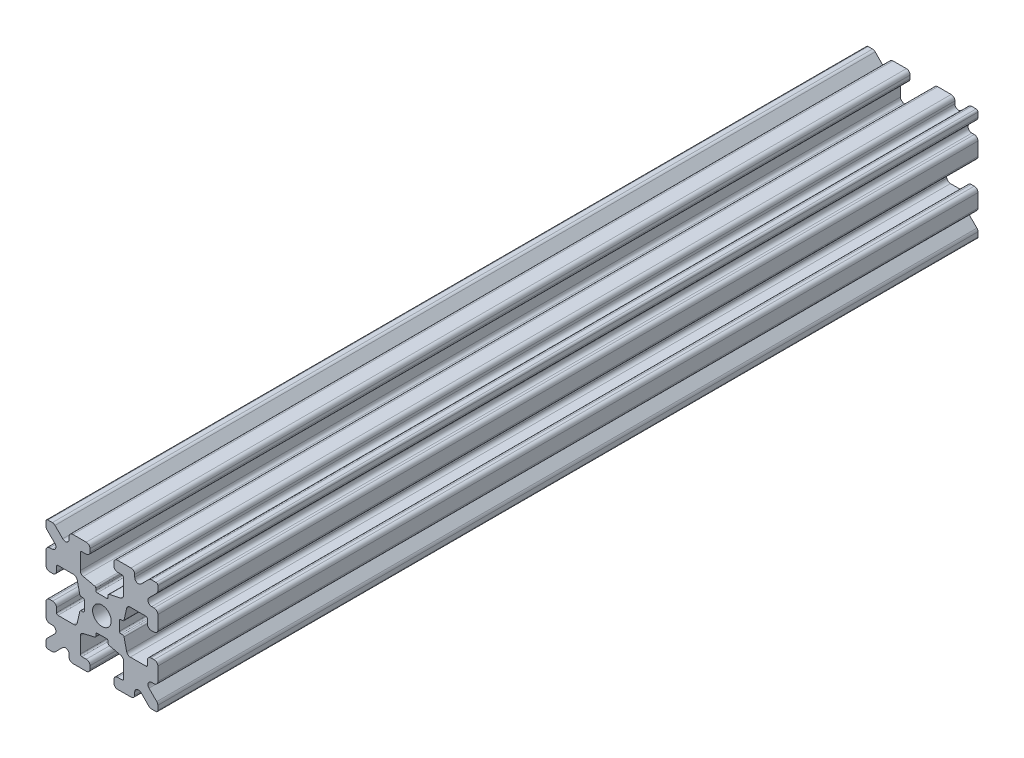
from build123d import *

# Parameters (mm, degrees)
SKETCH1_W           = 15
SKETCH1_H           = 15
SKETCH1_R           = 1.25
BOSS_EXTRUDE1_DEPTH = 55
FILLET1_R           = 0.25
CUT_EXTRUDE1_DEPTH  = 111.510180527
CUT_EXTRUDE3_DEPTH  = 111.510180527
FILLET3_R           = 0.5
FILLET4_R           = 0.5
FILLET5_R           = 3
FILLET6_R           = 0.2
CUT_EXTRUDE4_DEPTH  = 111.510180527
FILLET8_R           = 0.5
SKETCH6_W           = 5.1529354
SKETCH6_H           = 1.651
SKETCH6_W_2         = 1.651
SKETCH6_H_2         = 5.1529354
CUT_EXTRUDE5_DEPTH  = 111.510180527
FILLET10_R          = 0.2


with BuildPart() as part:
    # Sketch1 → Boss-Extrude1 (new, symmetric)
    with BuildSketch(Plane.XY):
        Rectangle(SKETCH1_W, SKETCH1_H)
        Circle(SKETCH1_R, mode=Mode.SUBTRACT)
    extrude(amount=BOSS_EXTRUDE1_DEPTH, both=True)

    # Fillet1
    fillet1_edges = [part.edges().sort_by_distance(p)[0] for p in [
        (7.5, -7.5, 0),
        (-7.5, -7.5, 0),
        (-7.5, 7.5, 0),
        (7.5, 7.5, 0),
    ]]
    fillet(fillet1_edges, radius=FILLET1_R)

    # Sketch2 → Cut-Extrude1 (cut, through all)
    with BuildSketch(Plane.XY.offset(55)):
        Polygon((-7.5, 1.6), (-6.1, 1.6), (-6.1, 2.9), (-3.4, 2.9), (-3.4, -2.9), (-6.1, -2.9), (-6.1, -1.6), (-7.5, -1.6), align=None)
        Polygon((2.9, 6.1), (1.6, 6.1), (1.6, 7.5), (-1.6, 7.5), (-1.6, 6.1), (-2.9, 6.1), (-2.9, 3.4), (2.9, 3.4), align=None)
        Polygon((-1.6, -7.5), (-1.6, -6.1), (-2.9, -6.1), (-2.9, -3.4), (2.9, -3.4), (2.9, -6.1), (1.6, -6.1), (1.6, -7.5), align=None)
        Polygon((6.1, -2.9), (6.1, -1.6), (7.5, -1.6), (7.5, 1.6), (6.1, 1.6), (6.1, 2.9), (3.4, 2.9), (3.4, -2.9), align=None)
    extrude(amount=-CUT_EXTRUDE1_DEPTH, mode=Mode.SUBTRACT)

    # Sketch4 → Cut-Extrude3 (cut, through all)
    with BuildSketch(Plane.XY.offset(55)):
        Polygon((-3.4, 2.9), (-2.75, 0), (-3.4, -2.9), align=None)
        Polygon((-2.9, 3.4), (0, 2.75), (2.9, 3.4), align=None)
        Polygon((3.4, 2.9), (2.75, 0), (3.4, -2.9), align=None)
        Polygon((-2.9, -3.4), (0, -2.75), (2.9, -3.4), align=None)
    extrude(amount=-CUT_EXTRUDE3_DEPTH, mode=Mode.SUBTRACT)

    # Fillet3
    fillet3_edges = [part.edges().sort_by_distance(p)[0] for p in [
        (1.6, -7.5, 0),
        (-1.6, -7.5, 0),
        (-1.6, -6.1, 0),
        (1.6, -6.1, 0),
        (6.1, 1.6, 0),
        (7.5, 1.6, 0),
        (7.5, -1.6, 0),
        (6.1, -1.6, 0),
        (-7.5, -1.6, 0),
        (-7.5, 1.6, 0),
        (-6.1, 1.6, 0),
        (-6.1, -1.6, 0),
        (-1.6, 6.1, 0),
        (-1.6, 7.5, 0),
        (1.6, 7.5, 0),
        (1.6, 6.1, 0),
    ]]
    fillet(fillet3_edges, radius=FILLET3_R)

    # Fillet4
    fillet4_edges = [part.edges().sort_by_distance(p)[0] for p in [
        (-2.9, -3.4, 0),
        (2.9, -3.4, 0),
        (3.4, -2.9, 0),
        (3.4, 2.9, 0),
        (-3.4, 2.9, 0),
        (-3.4, -2.9, 0),
        (2.9, 3.4, 0),
        (-2.9, 3.4, 0),
    ]]
    fillet(fillet4_edges, radius=FILLET4_R)

    # Fillet5
    fillet5_edges = [part.edges().sort_by_distance(p)[0] for p in [
        (-2.75, 0, 0),
        (0, 2.75, 0),
        (2.75, 0, 0),
        (0, -2.75, 0),
    ]]
    fillet(fillet5_edges, radius=FILLET5_R)

    # Fillet6
    fillet6_edges = [part.edges().sort_by_distance(p)[0] for p in [
        (-2.9, -6.1, 0),
        (2.9, -6.1, 0),
        (6.1, -2.9, 0),
        (6.1, 2.9, 0),
        (-6.1, 2.9, 0),
        (-6.1, -2.9, 0),
        (2.9, 6.1, 0),
        (-2.9, 6.1, 0),
    ]]
    fillet(fillet6_edges, radius=FILLET6_R)

    # Sketch5 → Cut-Extrude4 (cut, through all)
    with BuildSketch(Plane.XY.offset(55)):
        Polygon((-7.5, 6.439339828), (-5.460660172, 4.4), (-7.5, 4.4), align=None)
        Polygon((-6.439339828, 7.5), (-4.4, 5.460660172), (-4.4, 7.5), align=None)
        Polygon((4.4, 7.5), (6.439339828, 7.5), (4.4, 5.460660172), align=None)
        Polygon((7.5, 6.439339828), (7.5, 4.4), (5.460660172, 4.4), align=None)
        Polygon((7.5, -6.439339828), (5.460660172, -4.4), (7.5, -4.4), align=None)
        Polygon((6.439339828, -7.5), (4.4, -5.460660172), (4.4, -7.5), align=None)
        Polygon((-4.4, -7.5), (-6.439339828, -7.5), (-4.4, -5.460660172), align=None)
        Polygon((-7.5, -6.439339828), (-7.5, -4.4), (-5.460660172, -4.4), align=None)
    extrude(amount=-CUT_EXTRUDE4_DEPTH, mode=Mode.SUBTRACT)

    # Fillet8
    fillet8_edges = [part.edges().sort_by_distance(p)[0] for p in [
        (-7.5, 4.4, 0),
        (-7.5, 6.439339828, 0),
        (-5.460660172, 4.4, 0),
        (7.5, -4.4, 0),
        (7.5, -6.439339828, 0),
        (5.460660172, -4.4, 0),
        (5.460660172, 4.4, 0),
        (7.5, 6.439339828, 0),
        (7.5, 4.4, 0),
        (-4.4, 7.5, 0),
        (-4.4, 5.460660172, 0),
        (-6.439339828, 7.5, 0),
        (-5.460660172, -4.4, 0),
        (-7.5, -6.439339828, 0),
        (-7.5, -4.4, 0),
        (4.4, 5.460660172, 0),
        (4.4, 7.5, 0),
        (6.439339828, 7.5, 0),
        (6.439339828, -7.5, 0),
        (4.4, -7.5, 0),
        (4.4, -5.460660172, 0),
        (-6.439339828, -7.5, 0),
        (-4.4, -5.460660172, 0),
        (-4.4, -7.5, 0),
    ]]
    fillet(fillet8_edges, radius=FILLET8_R)

    # Sketch6 → Cut-Extrude5 (cut, through all)
    with BuildSketch(Plane.XY.offset(55)):
        with Locations((4.9235323, 0)):
            Rectangle(SKETCH6_W, SKETCH6_H)
        with Locations((0, -4.9235323)):
            Rectangle(SKETCH6_W_2, SKETCH6_H_2)
        with Locations((-4.9235323, 0)):
            Rectangle(SKETCH6_W, SKETCH6_H)
        with Locations((0, 4.9235323)):
            Rectangle(SKETCH6_W_2, SKETCH6_H_2)
    extrude(amount=-CUT_EXTRUDE5_DEPTH, mode=Mode.SUBTRACT)

    # Fillet10
    fillet10_edges = [part.edges().sort_by_distance(p)[0] for p in [
        (0.8255, -2.935025862, 0),
        (-0.8255, -2.935025862, 0),
        (0.8255, -2.3470646, 0),
        (-0.8255, -2.3470646, 0),
        (2.935025862, 0.8255, 0),
        (2.935025862, -0.8255, 0),
        (2.3470646, 0.8255, 0),
        (2.3470646, -0.8255, 0),
        (-2.935025862, -0.8255, 0),
        (-2.935025862, 0.8255, 0),
        (-2.3470646, -0.8255, 0),
        (-2.3470646, 0.8255, 0),
        (-0.8255, 2.935025862, 0),
        (0.8255, 2.935025862, 0),
        (-0.8255, 2.3470646, 0),
        (0.8255, 2.3470646, 0),
    ]]
    fillet(fillet10_edges, radius=FILLET10_R)


solid = part.part
